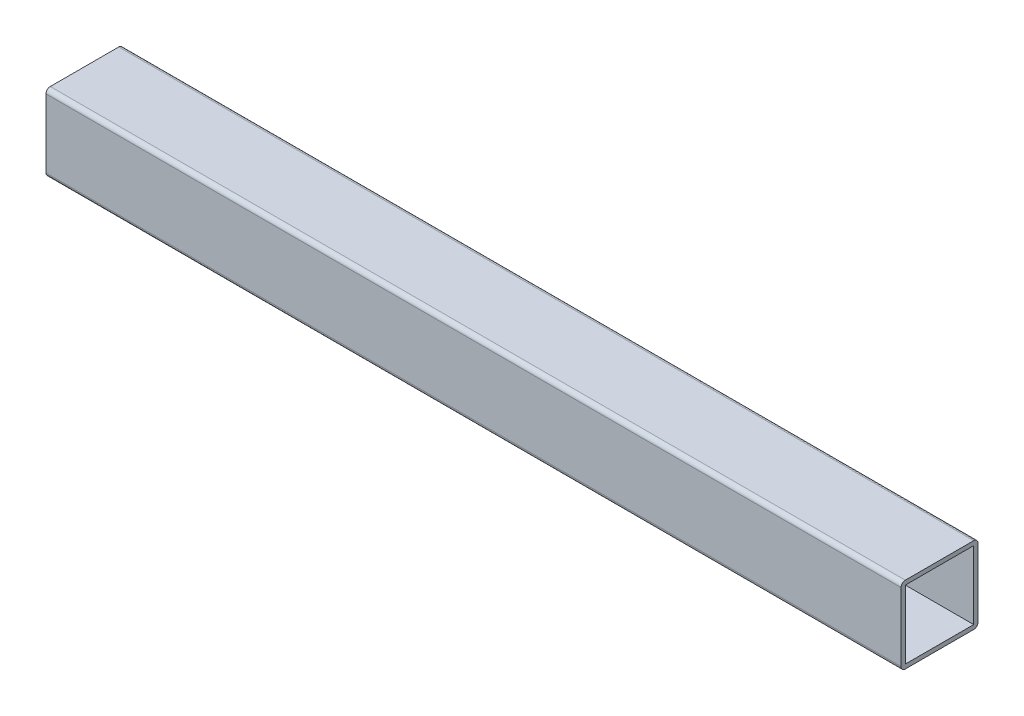
from build123d import *

# Parameters (mm, degrees)
SKETCH1_W      = 160
SKETCH1_H      = 160
EXTRUDE1_DEPTH = 2000


with BuildPart() as part:
    # Sketch1 → Extrude1 (new body)
    with BuildSketch(Plane(origin=(0, 0, 0), x_dir=(0, 0, -1), z_dir=(1, 0, 0))):
        with BuildLine():
            Line((10, 0), (170, 0))
            ThreePointArc((170, 0), (177.071067812, 2.928932188), (180, 10))
            Line((180, 10), (180, 170))
            ThreePointArc((180, 170), (177.071067812, 177.071067812), (170, 180))
            Line((170, 180), (10, 180))
            ThreePointArc((10, 180), (2.928932188, 177.071067812), (0, 170))
            Line((0, 170), (0, 10))
            ThreePointArc((0, 10), (2.928932188, 2.928932188), (10, 0))
        make_face()
        with Locations((90, 90)):
            Rectangle(SKETCH1_W, SKETCH1_H, mode=Mode.SUBTRACT)
    extrude(amount=EXTRUDE1_DEPTH)


solid = part.part
